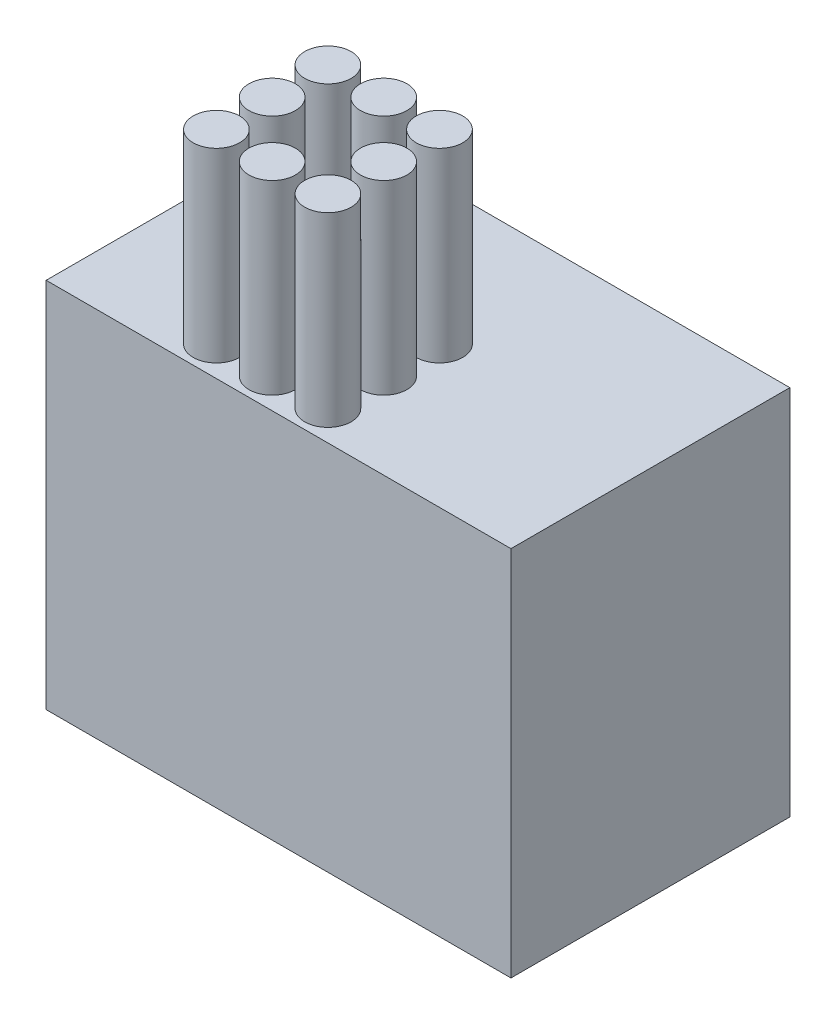
from build123d import *

# Parameters (mm, degrees)
SKETCH1_W            = 127
SKETCH1_H            = 101.6
BOSS_EXTRUDE1_DEPTH  = 76.2
SKETCH2_R            = 6.35
BOSS_EXTRUDE3_DEPTH  = 50.8
LPATTERN2_COUNT      = 3
LPATTERN2_PITCH      = 15.24
LPATTERN2_COUNT_DIR2 = 3
LPATTERN2_PITCH_DIR2 = 15.24


with BuildPart() as part:
    # Sketch1 → Boss-Extrude1 (new body)
    with BuildSketch(Plane.XY):
        with Locations((63.5, -50.8)):
            Rectangle(SKETCH1_W, SKETCH1_H)
    extrude(amount=BOSS_EXTRUDE1_DEPTH)

    # Sketch2 → Boss-Extrude3 (add)
    with BuildSketch(Plane(origin=(0, 0, 0), x_dir=(1, 0, 0), z_dir=(0, 1, 0))):
        with Locations(Location((68.819241674, -37.547351514, 0), (0, 0, 90))):
            Circle(SKETCH2_R)
    boss_extrude3 = extrude(amount=BOSS_EXTRUDE3_DEPTH)

    # LPattern2: Boss-Extrude3 3 × 3, 1 skipped
    with Locations(*[(-i * LPATTERN2_PITCH, 0, j * LPATTERN2_PITCH_DIR2) for i in range(LPATTERN2_COUNT) for j in range(LPATTERN2_COUNT_DIR2) if (i, j) not in ((0, 0), (1, 1))]):
        add(boss_extrude3)


solid = part.part
